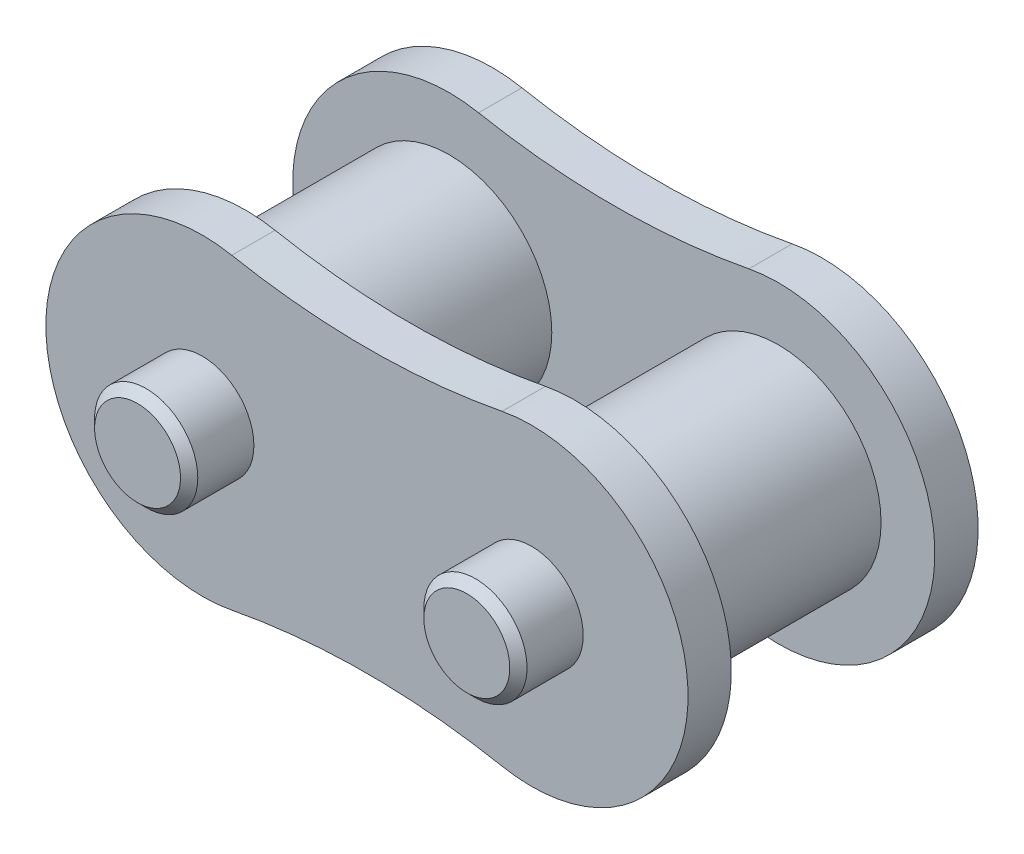
from build123d import *

# Parameters (mm, degrees)
SKETCH_2_R                 = 3.96
EXTRUDE_1_DEPTH            = 3.925
EXTRUDE_1_2_DEPTH          = 3.925
EXTRUDE_2_DEPTH            = 1.67
SKETCH_4_R                 = 1.99
EXTRUDE_3_DEPTH            = 2.4975
CHAMFER_1_SIZE             = 0.333
CHAMFER_1_OF_MIRROR_1_SIZE = 0.333


with BuildPart() as part:
    # 草图2 → 拉伸1 (new, symmetric)
    with BuildSketch(Plane.XY):
        with Locations((6.35, 0)):
            Circle(SKETCH_2_R)
    extrude(amount=EXTRUDE_1_DEPTH, both=True)



with BuildPart() as body_2:
    # 草图2 → Extrude 1 2 (new, symmetric)
    with BuildSketch(Plane.XY):
        with Locations((-6.35, 0)):
            Circle(SKETCH_2_R)
    extrude(amount=EXTRUDE_1_2_DEPTH, both=True)


with BuildPart() as part_1:
    add(part.part)

    add(body_2.part)  # 拉伸2 merges body 2
    # 草图3 → 拉伸2 (add)
    with BuildSketch(Plane.XY.offset(3.925)):
        with BuildLine():
            ThreePointArc((-5.213143439, 5.926953869), (-12.385, 0), (-5.213143439, -5.926953869))
            ThreePointArc((-5.213143439, -5.926953869), (0, -5.4315), (5.213143439, -5.926953869))
            ThreePointArc((5.213143439, -5.926953869), (12.385, 0), (5.213143439, 5.926953869))
            ThreePointArc((5.213143439, 5.926953869), (0, 5.4315), (-5.213143439, 5.926953869))
        make_face()
    extrude_2 = extrude(amount=EXTRUDE_2_DEPTH)

    # 草图4 → 拉伸3 (add)
    with BuildSketch(Plane.XY.offset(5.595)):
        with Locations((6.35, 0)):
            Circle(SKETCH_4_R)
        with Locations((-6.35, 0)):
            Circle(SKETCH_4_R)
    extrude_3 = extrude(amount=EXTRUDE_3_DEPTH)

    # 倒角1
    chamfer_1_edges = [part_1.edges().sort_by_distance(p)[0] for p in [
        (4.36, 0, 8.0925),
        (-8.34, 0, 8.0925),
    ]]
    chamfer(chamfer_1_edges, length=CHAMFER_1_SIZE)

    # 镜向1: 拉伸2, 拉伸3 across plane
    add(extrude_2.mirror(Plane.XY))
    add(extrude_3.mirror(Plane.XY))

    # 倒角1 of 镜向1
    chamfer_1_of_mirror_1_edges = [part_1.edges().sort_by_distance(p)[0] for p in [
        (4.36, 0, -8.0925),
        (-8.34, 0, -8.0925),
    ]]
    chamfer(chamfer_1_of_mirror_1_edges, length=CHAMFER_1_OF_MIRROR_1_SIZE)


solid = part_1.part
